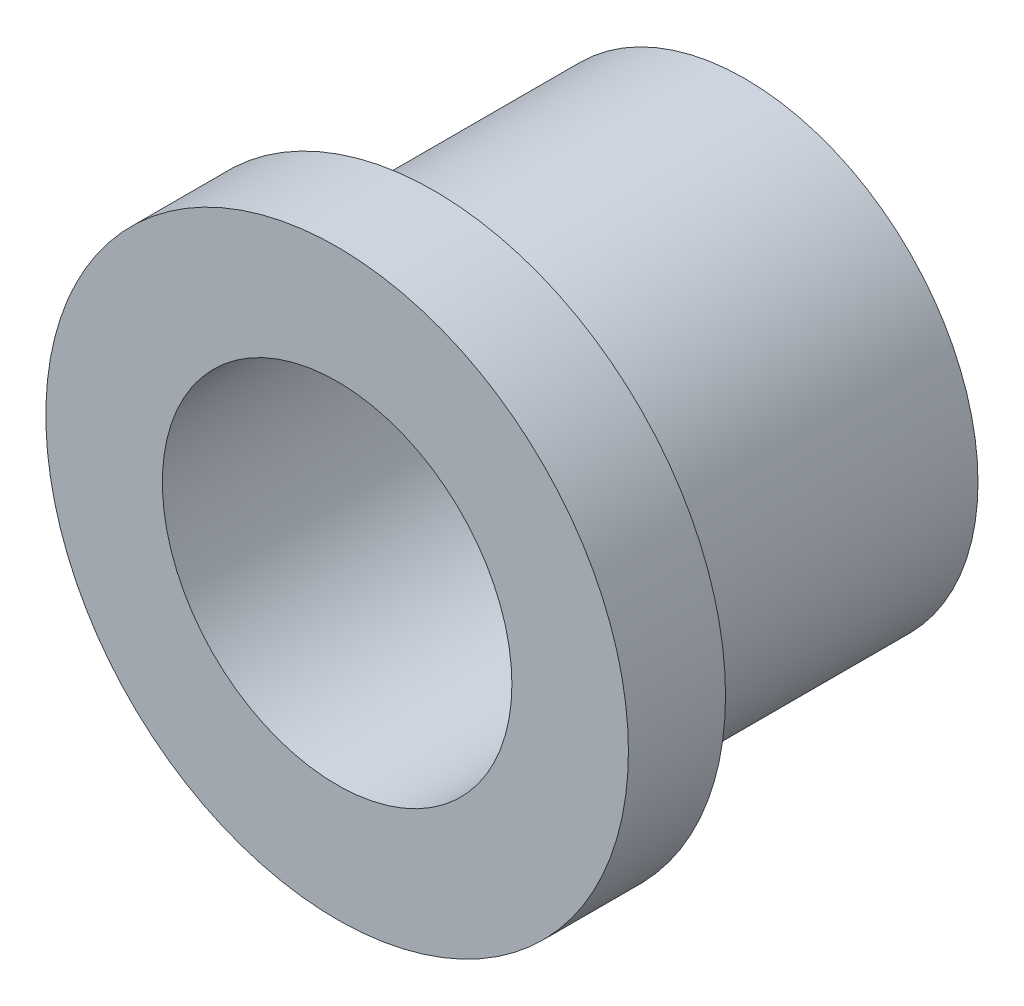
from build123d import *

# Parameters (mm, degrees)
SKETCH2_R           = 12
SKETCH2_R_2         = 9
BOSS_EXTRUDE1_DEPTH = 8
SKETCH3_R           = 15
SKETCH3_R_2         = 9
BOSS_EXTRUDE2_DEPTH = 5


with BuildPart() as part:
    # Sketch2 → Boss-Extrude1 (new, symmetric)
    with BuildSketch(Plane.XY):
        Circle(SKETCH2_R)
        Circle(SKETCH2_R_2, mode=Mode.SUBTRACT)
    extrude(amount=BOSS_EXTRUDE1_DEPTH, both=True)

    # Sketch3 → Boss-Extrude2 (add)
    with BuildSketch(Plane.XY.offset(8)):
        Circle(SKETCH3_R)
        Circle(SKETCH3_R_2, mode=Mode.SUBTRACT)
    extrude(amount=BOSS_EXTRUDE2_DEPTH)


solid = part.part
